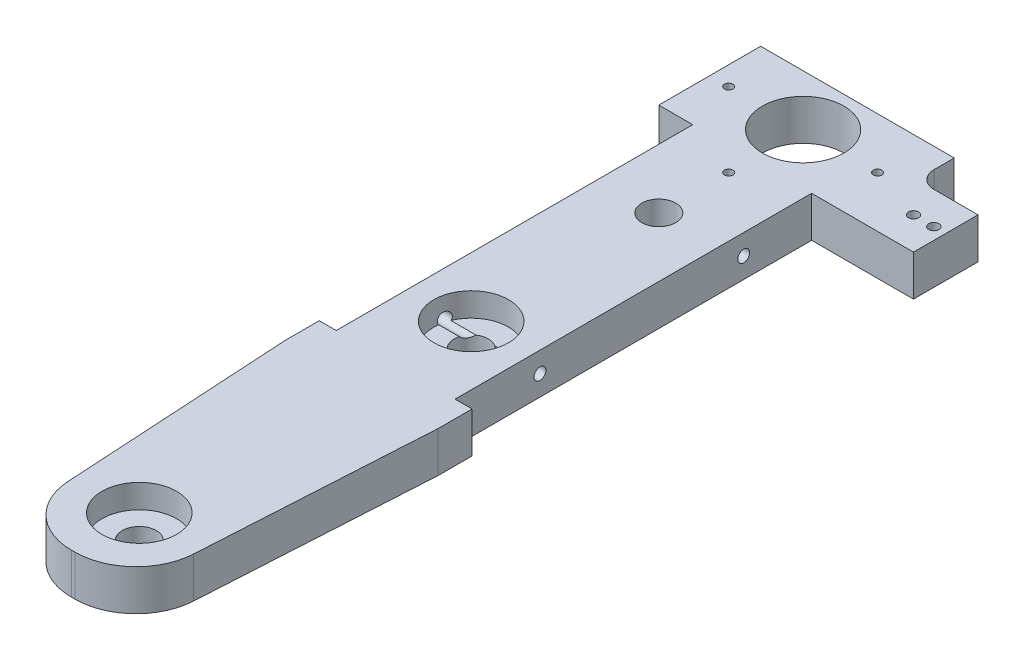
from build123d import *

# Parameters (mm, degrees)
SKETCH1_W           = 45
SKETCH1_H           = 250
BOSS_EXTRUDE1_DEPTH = 12
SKETCH2_W           = 5
SKETCH2_H           = 105
CUT_EXTRUDE1_DEPTH  = 12
SKETCH3_R           = 1.75
CUT_EXTRUDE2_DEPTH  = 35
SKETCH5_W           = 25
SKETCH5_H           = 30
SKETCH5_W_2         = 5
BOSS_EXTRUDE2_DEPTH = 12
SKETCH7_R           = 12
SKETCH7_R_2         = 1.25
CUT_EXTRUDE3_DEPTH  = 35
SKETCH8_W           = 18
SKETCH8_H           = 11
CUT_EXTRUDE4_DEPTH  = 12
SKETCH10_R          = 11
CUT_EXTRUDE5_DEPTH  = 7
SKETCH11_W          = 45
SKETCH11_H          = 20
CUT_EXTRUDE6_DEPTH  = 20
FILLET3_R           = 5
SKETCH12_R          = 5
CUT_EXTRUDE7_DEPTH  = 10
SKETCH13_R          = 1.5
CUT_EXTRUDE8_DEPTH  = 12
CUT_EXTRUDE9_DEPTH  = 20
FILLET4_R           = 18
SKETCH15_R          = 5
CUT_EXTRUDE10_DEPTH = 10


with BuildPart() as part:
    # Sketch1 → Boss-Extrude1 (new body)
    with BuildSketch(Plane(origin=(0, 0, 0), x_dir=(1, 0, 0), z_dir=(0, 1, 0))):
        Rectangle(SKETCH1_W, SKETCH1_H)
    extrude(amount=BOSS_EXTRUDE1_DEPTH)

    # Sketch2 → Cut-Extrude1 (cut)
    with BuildSketch(Plane(origin=(0, 12, 0), x_dir=(1, 0, 0), z_dir=(0, 1, 0))):
        with Locations((20, 42.5)):
            Rectangle(SKETCH2_W, SKETCH2_H)
        with Locations((-20, 42.5)):
            Rectangle(SKETCH2_W, SKETCH2_H)
    extrude(amount=-CUT_EXTRUDE1_DEPTH, mode=Mode.SUBTRACT)

    # Sketch3 → Cut-Extrude2 (cut)
    with BuildSketch(Plane(origin=(17.5, 0, 0), x_dir=(0, 0, -1), z_dir=(1, 0, 0))):
        with Locations((15, 6)):
            Circle(SKETCH3_R)
        with Locations((75, 6)):
            Circle(SKETCH3_R)
    extrude(amount=-CUT_EXTRUDE2_DEPTH, mode=Mode.SUBTRACT)

    # Sketch5 → Boss-Extrude2 (add)
    with BuildSketch(Plane(origin=(0, 12, 0), x_dir=(1, 0, 0), z_dir=(0, 1, 0))):
        with Locations((35, 110)):
            Rectangle(SKETCH5_W, SKETCH5_H)
        with Locations((-25, 110)):
            Rectangle(SKETCH5_W_2, SKETCH5_H)
    extrude(amount=-BOSS_EXTRUDE2_DEPTH)

    # Sketch7 → Cut-Extrude3 (cut)
    with BuildSketch(Plane(origin=(0, 12, 0), x_dir=(1, 0, 0), z_dir=(0, 1, 0))):
        with Locations(Location((0, 110, 0), (0, 0, 270))):
            Circle(SKETCH7_R)
        with Locations(Location((21.920310217, 110, 0), (0, 0, 270))):
            Circle(SKETCH7_R_2)
        with Locations(Location((-21.920310217, 110, 0), (0, 0, 270))):
            Circle(SKETCH7_R_2)
        with Locations(Location((0, 88.079689783, 0), (0, 0, 270))):
            Circle(SKETCH7_R_2)
    extrude(amount=-CUT_EXTRUDE3_DEPTH, mode=Mode.SUBTRACT)

    # Sketch8 → Cut-Extrude4 (cut)
    with BuildSketch(Plane(origin=(0, 12, 0), x_dir=(1, 0, 0), z_dir=(0, 1, 0))):
        with Locations((38.5, 119.5)):
            Rectangle(SKETCH8_W, SKETCH8_H)
    extrude(amount=-CUT_EXTRUDE4_DEPTH, mode=Mode.SUBTRACT)

    # Sketch10 → Cut-Extrude5 (cut)
    with BuildSketch(Plane(origin=(0, 12, 0), x_dir=(1, 0, 0), z_dir=(0, 1, 0))):
        with Locations(Location((0, 12.25, 0), (0, 0, 270))):
            Circle(SKETCH10_R)
        with Locations(Location((0, -85.5, 0), (0, 0, 270))):
            Circle(SKETCH10_R)
    extrude(amount=-CUT_EXTRUDE5_DEPTH, mode=Mode.SUBTRACT)

    # Sketch11 → Cut-Extrude6 (cut)
    with BuildSketch(Plane(origin=(0, 12, 0), x_dir=(1, 0, 0), z_dir=(0, 1, 0))):
        with Locations((0, -115)):
            Rectangle(SKETCH11_W, SKETCH11_H)
    extrude(amount=-CUT_EXTRUDE6_DEPTH, mode=Mode.SUBTRACT)

    # Fillet3
    fillet3_edges = [part.edges().sort_by_distance(p)[0] for p in [
        (29.5, 6, -114),
    ]]
    fillet(fillet3_edges, radius=FILLET3_R)

    # Sketch12 → Cut-Extrude7 (cut)
    with BuildSketch(Plane(origin=(0, 5, 0), x_dir=(1, 0, 0), z_dir=(0, 1, 0))):
        with Locations(Location((0, -85.5, 0), (0, 0, 270))):
            Circle(SKETCH12_R)
        with Locations(Location((0, 12.25, 0), (0, 0, 270))):
            Circle(SKETCH12_R)
    extrude(amount=-CUT_EXTRUDE7_DEPTH, mode=Mode.SUBTRACT)

    # Sketch13 → Cut-Extrude8 (cut)
    with BuildSketch(Plane(origin=(0, 12, 0), x_dir=(1, 0, 0), z_dir=(0, 1, 0))):
        with Locations(Location((38, 104.5, 0), (0, 0, 270))):
            Circle(SKETCH13_R)
        with Locations(Location((44, 104.5, 0), (0, 0, 270))):
            Circle(SKETCH13_R)
    extrude(amount=-CUT_EXTRUDE8_DEPTH, mode=Mode.SUBTRACT)

    # Sketch14 → Cut-Extrude9 (cut)
    with BuildSketch(Plane(origin=(0, 12, 0), x_dir=(1, 0, 0), z_dir=(0, 1, 0))):
        Polygon((-22.5, -20), (-22.5, -105), (-17.5, -105), align=None)
        Polygon((17.5, -105), (22.5, -20), (22.5, -105), align=None)
    extrude(amount=-CUT_EXTRUDE9_DEPTH, mode=Mode.SUBTRACT)

    # Fillet4
    fillet4_edges = [part.edges().sort_by_distance(p)[0] for p in [
        (17.5, 6, 105),
        (-17.5, 6, 105),
    ]]
    fillet(fillet4_edges, radius=FILLET4_R)

    # Sketch15 → Cut-Extrude10 (cut)
    with BuildSketch(Plane(origin=(0, 12, 0), x_dir=(1, 0, 0), z_dir=(0, 1, 0))):
        with Locations(Location((0, 67.5, 0), (0, 0, 270))):
            Circle(SKETCH15_R)
    extrude(amount=-CUT_EXTRUDE10_DEPTH, mode=Mode.SUBTRACT)


solid = part.part
